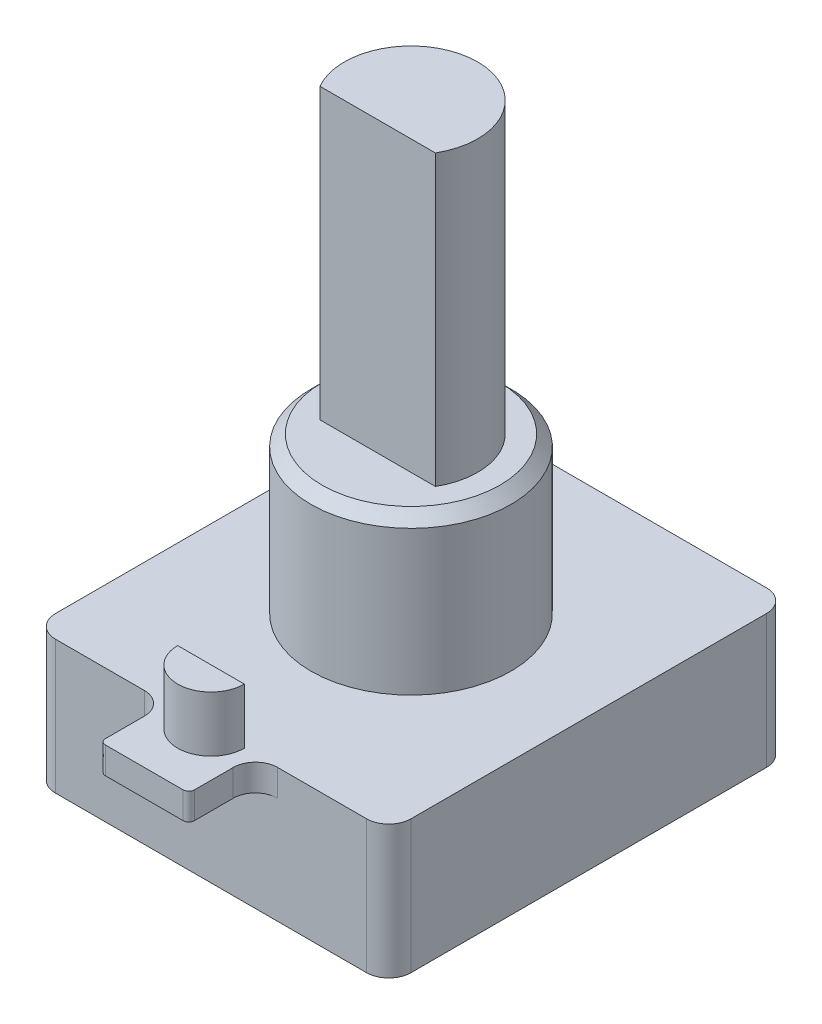
from build123d import *

# Parameters (mm, degrees)
SKETCH_1_W      = 16
SKETCH_1_H      = 18
EXTRUDE_1_DEPTH = 6
FILLET_1_R      = 1
SKETCH_2_W      = 4
SKETCH_2_H      = 1.2
EXTRUDE_2_DEPTH = 3
FILLET_2_R      = 1
FILLET_3_R      = 0.25
SKETCH_3_R      = 4.5
EXTRUDE_3_DEPTH = 7
CHAMFER_1_SIZE  = 0.5
EXTRUDE_4_DEPTH = 13
EXTRUDE_5_DEPTH = 2.5


with BuildPart() as part:
    # Эскиз1 → Бобышка-Вытянуть1 (new body)
    with BuildSketch(Plane(origin=(0, 0, 0), x_dir=(1, 0, 0), z_dir=(0, 1, 0))):
        Rectangle(SKETCH_1_W, SKETCH_1_H)
    extrude(amount=EXTRUDE_1_DEPTH)

    # Скругление1
    fillet_1_edges = [part.edges().sort_by_distance(p)[0] for p in [
        (8, 3, 9),
        (-8, 3, 9),
        (-8, 3, -9),
        (8, 3, -9),
    ]]
    fillet(fillet_1_edges, radius=FILLET_1_R)

    # Эскиз2 → Бобышка-Вытянуть2 (add)
    with BuildSketch(Plane.XY.offset(9)):
        with Locations((0, 5.4)):
            Rectangle(SKETCH_2_W, SKETCH_2_H)
    extrude(amount=EXTRUDE_2_DEPTH)

    # Скругление2
    fillet_2_edges = [part.edges().sort_by_distance(p)[0] for p in [
        (2, 5.4, 9),
        (-2, 5.4, 9),
    ]]
    fillet(fillet_2_edges, radius=FILLET_2_R)

    # Скругление3
    fillet_3_edges = [part.edges().sort_by_distance(p)[0] for p in [
        (2, 5.4, 12),
        (-2, 5.4, 12),
    ]]
    fillet(fillet_3_edges, radius=FILLET_3_R)

    # Эскиз3 → Бобышка-Вытянуть3 (add)
    with BuildSketch(Plane(origin=(0, 6, 0), x_dir=(1, 0, 0), z_dir=(0, 1, 0))):
        with Locations(Location((0, 0, 0), (0, 0, 270))):
            Circle(SKETCH_3_R)
    extrude(amount=EXTRUDE_3_DEPTH)

    # Фаска1
    chamfer_1_edges = [part.edges().sort_by_distance(p)[0] for p in [
        (0, 13, -4.5),
    ]]
    chamfer(chamfer_1_edges, length=CHAMFER_1_SIZE)

    # Эскиз4 → Бобышка-Вытянуть4 (add)
    with BuildSketch(Plane(origin=(0, 13, 0), x_dir=(1, 0, 0), z_dir=(0, 1, 0))):
        with BuildLine():
            Line((-2.598076211, -1.5), (2.598076211, -1.5))
            ThreePointArc((2.598076211, -1.5), (0, 3), (-2.598076211, -1.5))
        make_face()
    extrude(amount=EXTRUDE_4_DEPTH)

    # Эскиз5 → Бобышка-Вытянуть5 (add)
    with BuildSketch(Plane(origin=(0, 6, 0), x_dir=(1, 0, 0), z_dir=(0, 1, 0))):
        with BuildLine():
            Line((-1.5, -9), (1.5, -9))
            ThreePointArc((1.5, -9), (0, -10.5), (-1.5, -9))
        make_face()
    extrude(amount=EXTRUDE_5_DEPTH)


solid = part.part
